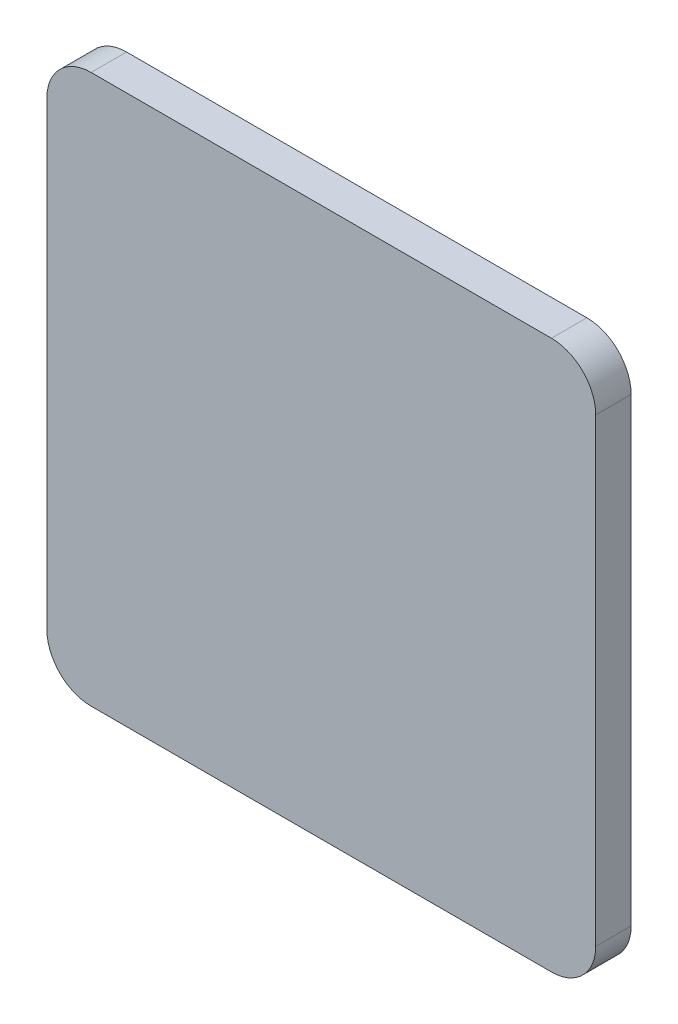
from build123d import *

# Parameters (mm, degrees)
ESTRUSIONE_ESTRUSIONE1_DEPTH = 2


with BuildPart() as part:
    # Schizzo1 → Estrusione-Estrusione1 (new body)
    with BuildSketch(Plane.XY):
        with BuildLine():
            Line((-37.208571836, -35.297366731), (-63.208571836, -35.297366731))
            ThreePointArc((-63.208571836, -35.297366731), (-64.976338789, -34.565133683), (-65.708571836, -32.797366731))
            Line((-65.708571836, -32.797366731), (-65.708571836, -6.797366731))
            ThreePointArc((-65.708571836, -6.797366731), (-64.976338789, -5.029599778), (-63.208571836, -4.297366731))
            Line((-63.208571836, -4.297366731), (-37.208571836, -4.297366731))
            ThreePointArc((-37.208571836, -4.297366731), (-35.440804883, -5.029599778), (-34.708571836, -6.797366731))
            Line((-34.708571836, -6.797366731), (-34.708571836, -32.797366731))
            ThreePointArc((-34.708571836, -32.797366731), (-35.440804883, -34.565133683), (-37.208571836, -35.297366731))
        make_face()
    extrude(amount=ESTRUSIONE_ESTRUSIONE1_DEPTH)


solid = part.part
